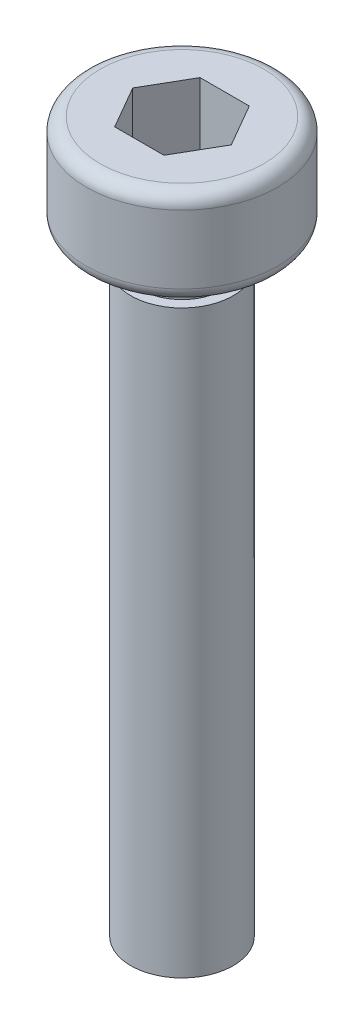
from build123d import *

# Parameters (mm, degrees)
CUT_EXTRUDE_1_DEPTH = 2


with BuildPart() as part:
    # 草图1 → 旋转1 (revolve)
    with BuildSketch(Plane.XY, mode=Mode.PRIVATE) as revolve_1_sk:
        with BuildLine():
            Line((0, 20.8), (-2.4, 20.8))
            ThreePointArc((-2.4, 20.8), (-2.682842712, 20.682842712), (-2.8, 20.4))
            Line((-2.8, 20.4), (-2.8, 18.4))
            ThreePointArc((-2.8, 18.4), (-2.682842712, 18.117157288), (-2.4, 18))
            Line((-2.4, 18), (-1.2, 18))
            Line((-1.2, 18), (-1.2, 17))
            Line((-1.2, 17), (-1.5, 17))
            Line((-1.5, 17), (-1.5, 0))
            Line((-1.5, 0), (0, 0))
            Line((0, 0), (0, 20.8))
        make_face()
    revolve(revolve_1_sk.sketch.rotate(Axis((0, 0, 0), (0, 1, 0)), 270), axis=Axis((0, 0, 0), (0, 1, 0)))

    # 草图2 → 切除-拉伸1 (cut)
    with BuildSketch(Plane(origin=(0, 20.8, 0), x_dir=(1, 0, 0), z_dir=(0, 1, 0))):
        Polygon((-0.721687836, 1.25), (-1.443375673, 0), (-0.721687836, -1.25), (0.721687836, -1.25), (1.443375673, 0), (0.721687836, 1.25), align=None)
    extrude(amount=-CUT_EXTRUDE_1_DEPTH, mode=Mode.SUBTRACT)


solid = part.part
